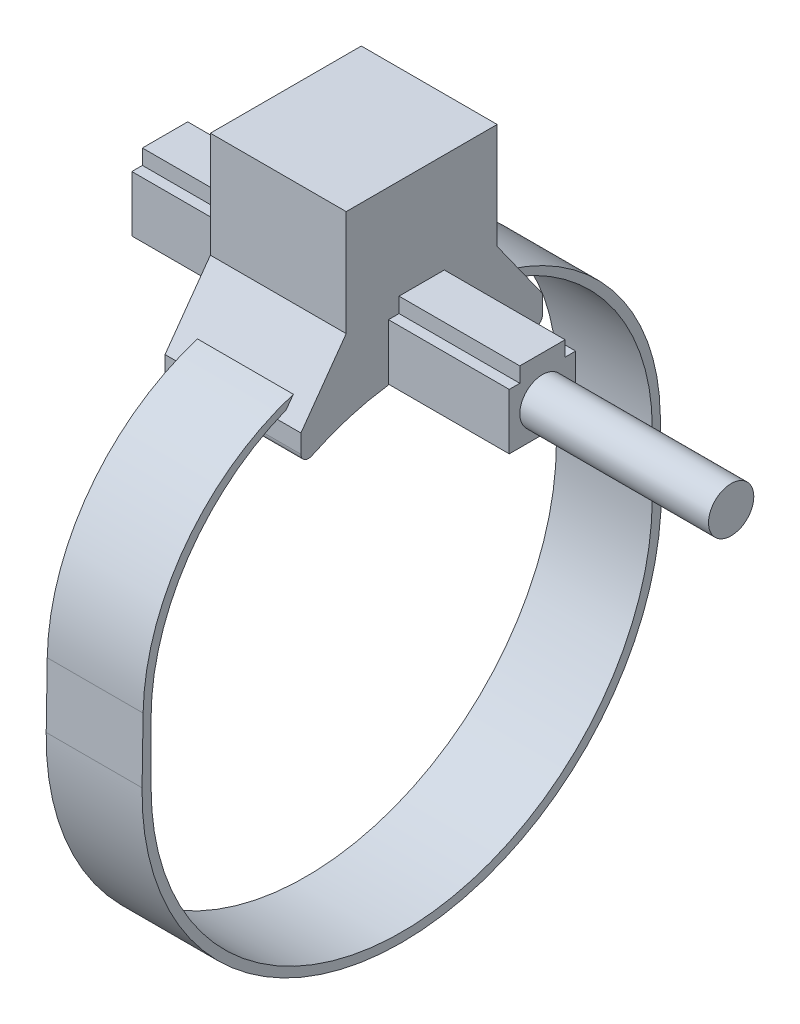
from build123d import *

# Parameters (mm, degrees)
EXTRUDE_1_DEPTH      = 4.5
EXTRUDE_1_DEPTH_BACK = 4.5
EXTRUDE_2_DEPTH      = 3.175
EXTRUDE_2_DEPTH_BACK = 3.175
EXTRUDE_3_DEPTH      = 12.5
EXTRUDE_3_DEPTH_BACK = 12.5
SKETCH_4_R           = 1.5
EXTRUDE_4_DEPTH      = 25


with BuildPart() as part:
    # 草图1 → 凸台-拉伸1 (new, two sides: drawn at the far end of the back side and taken through both)
    with BuildSketch(Plane(origin=(11.5, 0, 0), x_dir=(0, 0, -1), z_dir=(1, 0, 0)).offset(-EXTRUDE_1_DEPTH_BACK)):
        with BuildLine():
            Line((-8, 16.7), (-8, 15.478695035))
            ThreePointArc((-8, 15.478695035), (-7.765507447, 15.055013793), (-7.281976818, 15.028732935))
            ThreePointArc((-7.281976818, 15.028732935), (-4.801971314, 15.994720113), (-2.2, 16.554455594))
            Line((-2.2, 16.554455594), (-2.2, 19.9))
            Line((-2.2, 19.9), (-1.5, 19.9))
            Line((-1.5, 19.9), (-1.5, 20.9))
            Line((-1.5, 20.9), (1.5, 20.9))
            Line((1.5, 20.9), (1.5, 19.9))
            Line((1.5, 19.9), (2.2, 19.9))
            Line((2.2, 19.9), (2.2, 16.554455594))
            ThreePointArc((2.2, 16.554455594), (4.801971275, 15.994720125), (7.281976744, 15.02873297))
            ThreePointArc((7.281976744, 15.02873297), (7.765507412, 15.055013771), (8, 15.478695035))
            Line((8, 15.478695035), (8, 16.7))
            Line((8, 16.7), (5, 20.9))
            Line((5, 20.9), (5, 27.9))
            Line((5, 27.9), (-5, 27.9))
            Line((-5, 27.9), (-5, 20.9))
            Line((-5, 20.9), (-8, 16.7))
        make_face()
    extrude(amount=EXTRUDE_1_DEPTH + EXTRUDE_1_DEPTH_BACK)

    # 草图2 → 凸台-拉伸2 (add, two sides: drawn at the far end of the back side and taken through both)
    with BuildSketch(Plane(origin=(11.5, 0, 0), x_dir=(0, 0, -1), z_dir=(1, 0, 0)).offset(-EXTRUDE_2_DEPTH_BACK)):
        with BuildLine():
            Line((17.197704205, 0.281016159), (17.128241699, 4.532001712))
            ThreePointArc((17.128241699, 4.532001712), (12.888690566, 14.42260896), (2.930137065, 18.5))
            Line((2.930137065, 18.5), (-2.930137065, 18.5))
            ThreePointArc((-2.930137065, 18.5), (-12.888690566, 14.42260896), (-17.128241699, 4.532001712))
            Line((-17.128241699, 4.532001712), (-17.197704205, 0.281016159))
            ThreePointArc((-17.197704205, 0.281016159), (0, -17.2), (17.197704205, 0.281016159))
        make_face()
        with BuildLine():
            Line((16.6, 0), (16.6, 4))
            ThreePointArc((16.6, 4), (12.440916293, 14.040916293), (2.4, 18.2))
            Line((2.4, 18.2), (-2.4, 18.2))
            ThreePointArc((-2.4, 18.2), (-12.440916293, 14.040916293), (-16.6, 4))
            Line((-16.6, 4), (-16.6, 0))
            ThreePointArc((-16.6, 0), (0, -16.6), (16.6, 0))
        make_face(mode=Mode.SUBTRACT)
    extrude(amount=EXTRUDE_2_DEPTH + EXTRUDE_2_DEPTH_BACK)

    # 草图3 → 凸台-拉伸3 (add, two sides: drawn at the far end of the back side and taken through both)
    with BuildSketch(Plane(origin=(11.5, 0, 0), x_dir=(0, 0, -1), z_dir=(1, 0, 0)).offset(-EXTRUDE_3_DEPTH_BACK)):
        Polygon((-2.2, 20.3), (-2.2, 16.6), (2.2, 16.6), (2.2, 20.3), (1.5, 20.3), (1.5, 21.3), (-1.5, 21.3), (-1.5, 20.3), align=None)
    extrude(amount=EXTRUDE_3_DEPTH + EXTRUDE_3_DEPTH_BACK)

    # 草图4 → 凸台-拉伸4 (add)
    with BuildSketch(Plane(origin=(11.5, 0, 0), x_dir=(0, 0, -1), z_dir=(1, 0, 0))):
        with Locations((0, 18.55)):
            Circle(SKETCH_4_R)
    extrude(amount=EXTRUDE_4_DEPTH)


solid = part.part
